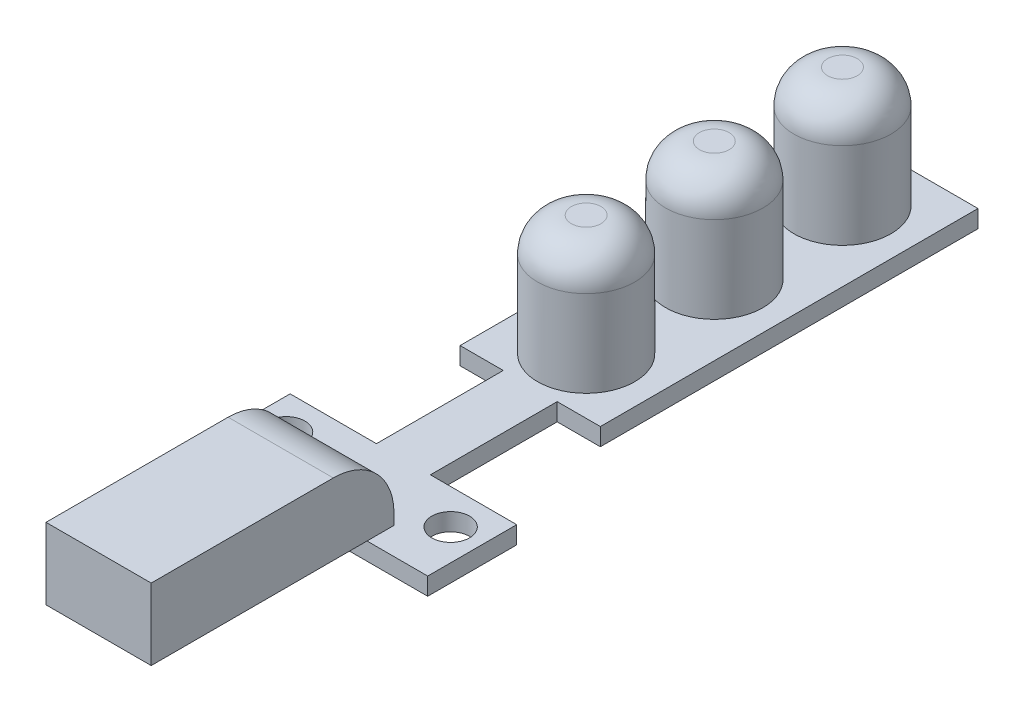
from build123d import *

# Parameters (mm, degrees)
SKETCH1_W           = 13.208
SKETCH1_H           = 35.56
SKETCH1_W_2         = 5.08
SKETCH1_H_2         = 11.938
SKETCH1_W_3         = 21.336
SKETCH1_H_3         = 8.382
SKETCH1_R           = 1.778
BOSS_EXTRUDE1_DEPTH = 1.651
SKETCH2_R           = 4.572
BOSS_EXTRUDE2_DEPTH = 11.303
FILLET1_R           = 3.175
SKETCH3_W           = 9.906
SKETCH3_H           = 2.54
SKETCH3_H_2         = 20.32
BOSS_EXTRUDE3_DEPTH = 6.731
FILLET2_R           = 5.715


with BuildPart() as part:
    # Sketch1 → Boss-Extrude1 (new body)
    # profile 1 of 3: a face of its own
    with BuildSketch(Plane(origin=(0, 0, 0), x_dir=(1, 0, 0), z_dir=(0, 1, 0))):
        Rectangle(SKETCH1_W, SKETCH1_H)
    # profile 2 of 3: a face of its own
    with BuildSketch(Plane(origin=(0, 0, 0), x_dir=(1, 0, 0), z_dir=(0, 1, 0))):
        with Locations((0, -23.749)):
            Rectangle(SKETCH1_W_2, SKETCH1_H_2)
    # profile 3 of 3: a face of its own
    with BuildSketch(Plane(origin=(0, 0, 0), x_dir=(1, 0, 0), z_dir=(0, 1, 0))):
        with Locations((0, -33.909)):
            Rectangle(SKETCH1_W_3, SKETCH1_H_3)
        with Locations(Location((-7.747, -33.02, 0), (0, 0, 90))):
            Circle(SKETCH1_R, mode=Mode.SUBTRACT)
        with Locations(Location((7.747, -33.02, 0), (0, 0, 90))):
            Circle(SKETCH1_R, mode=Mode.SUBTRACT)
    extrude(amount=BOSS_EXTRUDE1_DEPTH)

    # Sketch2 → Boss-Extrude2 (add)
    with BuildSketch(Plane(origin=(0, 1.651, 0), x_dir=(1, 0, 0), z_dir=(0, 1, 0))):
        with Locations(Location((0, 11.6205, 0), (0, 0, 90))):
            Circle(SKETCH2_R)
        with Locations(Location((0, -0.4445, 0), (0, 0, 90))):
            Circle(SKETCH2_R)
        with Locations(Location((0, -12.5095, 0), (0, 0, 90))):
            Circle(SKETCH2_R)
    extrude(amount=BOSS_EXTRUDE2_DEPTH)

    # Fillet1
    fillet1_edges = [part.edges().sort_by_distance(p)[0] for p in [
        (0, 12.954, -7.0485),
        (0, 12.954, 5.0165),
        (0, 12.954, 17.0815),
    ]]
    fillet(fillet1_edges, radius=FILLET1_R)

    # Sketch3 → Boss-Extrude3 (add)
    with BuildSketch(Plane(origin=(0, 1.651, 0), x_dir=(1, 0, 0), z_dir=(0, 1, 0))):
        with Locations((0, -36.83)):
            Rectangle(SKETCH3_W, SKETCH3_H)
        with Locations((0, -48.26)):
            Rectangle(SKETCH3_W, SKETCH3_H_2)
    extrude(amount=BOSS_EXTRUDE3_DEPTH)

    # Fillet2
    fillet2_edges = [part.edges().sort_by_distance(p)[0] for p in [
        (0, 8.382, 35.56),
    ]]
    fillet(fillet2_edges, radius=FILLET2_R)


solid = part.part
